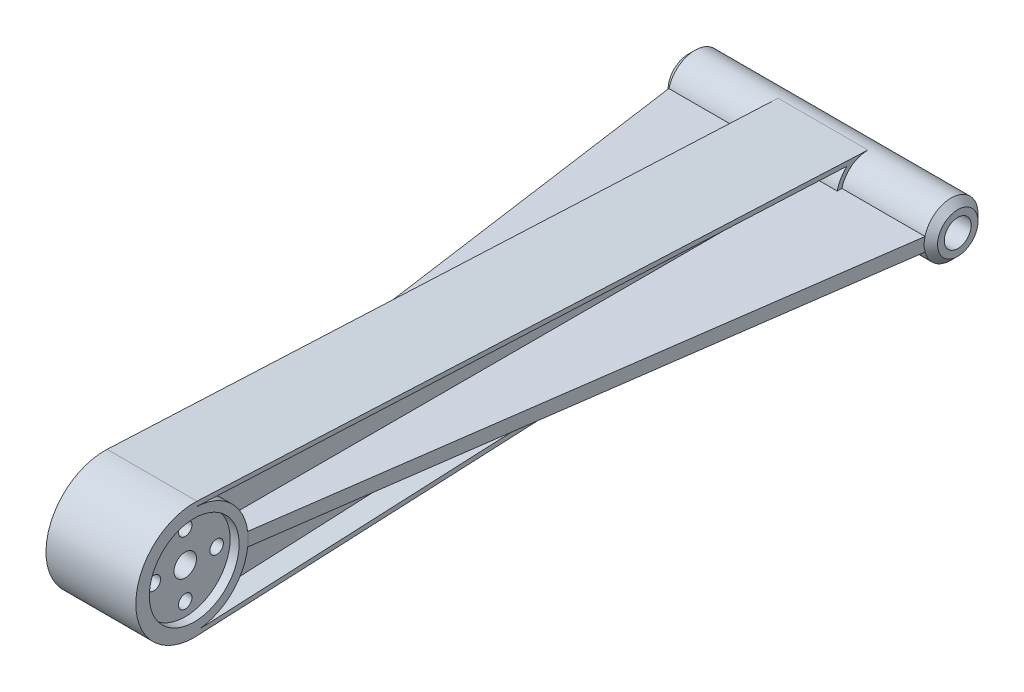
from build123d import *

# Parameters (mm, degrees)
EXTRUDE_1_DEPTH     = 10
SKETCH_2_R          = 10
CUT_EXTRUDE_1_DEPTH = 2
CUT_EXTRUDE_START   = -2
SKETCH_4_R          = 10
CUT_EXTRUDE_2_DEPTH = 2
SKETCH_5_R          = 1.5
SKETCH_5_R_2        = 2.5
CUT_EXTRUDE_3_DEPTH = 158.572205671
SKETCH_7_R          = 6
EXTRUDE_3_DEPTH     = 30
SKETCH_8_R          = 3
CUT_EXTRUDE_4_DEPTH = 168.645459229
CHAMFER_1_SIZE      = 1.5
CUT_EXTRUDE_5_DEPTH = 5
RIB_1_REACH         = 161.389
SKETCH_10_WALL_W    = 454.069017414
SKETCH_10_WALL_H    = 3


with BuildPart() as part:
    # 草图1 → 凸台-拉伸1 (new, symmetric)
    with BuildSketch(Plane(origin=(0, 0, 0), x_dir=(0, 0, -1), z_dir=(1, 0, 0))):
        with BuildLine():
            Line((13, 0), (-13, 0))
            ThreePointArc((-13, 0), (-9.192388155, -9.192388155), (0, -13))
            Line((0, -13), (1.210696705, -12.94350082))
            ThreePointArc((1.210696705, -12.94350082), (9.610906751, -8.753883219), (13, 0))
        make_face()
        with BuildLine():
            ThreePointArc((0.607234259, 12.9858102), (-8.975131047, 9.404627727), (-13, 0))
            Line((-13, 0), (13, 0))
            ThreePointArc((13, 0), (9.404627727, 8.975131047), (0.607234259, 12.9858102))
        make_face()
        with BuildLine():
            ThreePointArc((0.607234259, 12.9858102), (9.404627727, 8.975131047), (13, 0))
            Line((13, 0), (144, 0))
            ThreePointArc((144, 0), (145.757359313, 4.242640687), (150, 6))
            Line((150, 6), (0.607234259, 12.9858102))
        make_face()
        with BuildLine():
            Line((144, 0), (13, 0))
            ThreePointArc((13, 0), (9.610906751, -8.753883219), (1.210696705, -12.94350082))
            Line((1.210696705, -12.94350082), (150, -6))
            ThreePointArc((150, -6), (145.757359313, -4.242640687), (144, 0))
        make_face()
        with BuildLine():
            ThreePointArc((150, 6), (145.757359313, 4.242640687), (144, 0))
            Line((144, 0), (156, 0))
            ThreePointArc((156, 0), (154.242640687, 4.242640687), (150, 6))
        make_face()
        with BuildLine():
            Line((156, 0), (144, 0))
            ThreePointArc((144, 0), (145.757359313, -4.242640687), (150, -6))
            ThreePointArc((150, -6), (154.242640687, -4.242640687), (156, 0))
        make_face()
        with BuildLine():
            ThreePointArc((150, 6), (145.757359313, 4.242640687), (144, 0))
            Line((144, 0), (156, 0))
            ThreePointArc((156, 0), (154.242640687, 4.242640687), (150, 6))
        make_face()
        with BuildLine():
            Line((156, 0), (144, 0))
            ThreePointArc((144, 0), (145.757359313, -4.242640687), (150, -6))
            ThreePointArc((150, -6), (154.242640687, -4.242640687), (156, 0))
        make_face()
    extrude(amount=EXTRUDE_1_DEPTH, both=True)

    # 草图2 → 切除-拉伸1 (cut)
    with BuildSketch(Plane.ZY.offset(10)):
        Circle(SKETCH_2_R)
    extrude(amount=-CUT_EXTRUDE_1_DEPTH, mode=Mode.SUBTRACT)

    # 草图4 → 切除-拉伸2 (cut)
    with BuildSketch(Plane(origin=(10, 0, 0), x_dir=(0, 0, -1), z_dir=(1, 0, 0)).offset(CUT_EXTRUDE_START)):
        with Locations(Location((0, 0, 0), (0, 0, 180))):
            Circle(SKETCH_4_R)
    extrude(amount=CUT_EXTRUDE_2_DEPTH, mode=Mode.SUBTRACT)

    # 草图5 → 切除-拉伸3 (cut, through all)
    with BuildSketch(Plane(origin=(8, 0, 0), x_dir=(0, 0, -1), z_dir=(1, 0, 0))):
        with Locations((7, 0)):
            Circle(SKETCH_5_R)
        with Locations((0, 7)):
            Circle(SKETCH_5_R)
        with Locations((-7, 0)):
            Circle(SKETCH_5_R)
        with Locations((0, -7)):
            Circle(SKETCH_5_R)
        Circle(SKETCH_5_R_2)
    extrude(amount=-CUT_EXTRUDE_3_DEPTH, mode=Mode.SUBTRACT)

    # 草图7 → 凸台-拉伸3 (add, symmetric)
    with BuildSketch(Plane(origin=(0, 0, 0), x_dir=(0, 0, -1), z_dir=(1, 0, 0))):
        with Locations((150, 0)):
            Circle(SKETCH_7_R)
    extrude(amount=EXTRUDE_3_DEPTH, both=True)

    # 草图8 → 切除-拉伸4 (cut, through all)
    with BuildSketch(Plane(origin=(30, 0, 0), x_dir=(0, 0, -1), z_dir=(1, 0, 0))):
        with Locations((150, 0)):
            Circle(SKETCH_8_R)
    extrude(amount=-CUT_EXTRUDE_4_DEPTH, mode=Mode.SUBTRACT)

    # 倒角1
    chamfer_1_edges = [part.edges().sort_by_distance(p)[0] for p in [
        (-30, 0, -144),
        (30, 0, -144),
    ]]
    chamfer(chamfer_1_edges, length=CHAMFER_1_SIZE)

    # 草图9 → 切除-拉伸5 (cut)
    with BuildSketch(Plane.ZY.offset(10)):
        with BuildLine():
            Line((-145.332480771, -5.216729267), (-1.140319123, -11.945696811))
            ThreePointArc((-1.140319123, -11.945696811), (-11.996480106, 0.290628762), (-0.560523931, 11.986901723))
            Line((-0.560523931, 11.986901723), (-145.332945614, 5.217145135))
            ThreePointArc((-145.332945614, 5.217145135), (-143.000000007, 0.000311859), (-145.332480771, -5.216729267))
        make_face()
    cut_extrude_5 = extrude(amount=-CUT_EXTRUDE_5_DEPTH, mode=Mode.SUBTRACT)

    # 镜向1: 切除-拉伸5 across plane
    add(cut_extrude_5.mirror(Plane(origin=(0, 0, 0), x_dir=(0, 0, 1), z_dir=(1, 0, 0))), mode=Mode.SUBTRACT)

    # 草图10 wall → 筋1 (add, up to next)
    with BuildSketch(Plane(origin=(-19.25, 0, -78), x_dir=(0.138795007241, 0, 0.990321132747), z_dir=(0.990321132747, 0, -0.138795007241)), mode=Mode.PRIVATE) as rib_1_sk1:
        Rectangle(SKETCH_10_WALL_W, SKETCH_10_WALL_H)
    rib_1_tool1 = extrude(rib_1_sk1.sketch, amount=RIB_1_REACH, mode=Mode.PRIVATE) - part.part
    rib_1 = rib_1_tool1.solids().sort_by_distance((-19.25, 0, -78))[0]
    add(rib_1)

    # 镜向2: 筋1 across plane
    add(rib_1.mirror(Plane(origin=(0, 0, 0), x_dir=(0, 0, 1), z_dir=(1, 0, 0))))


solid = part.part
